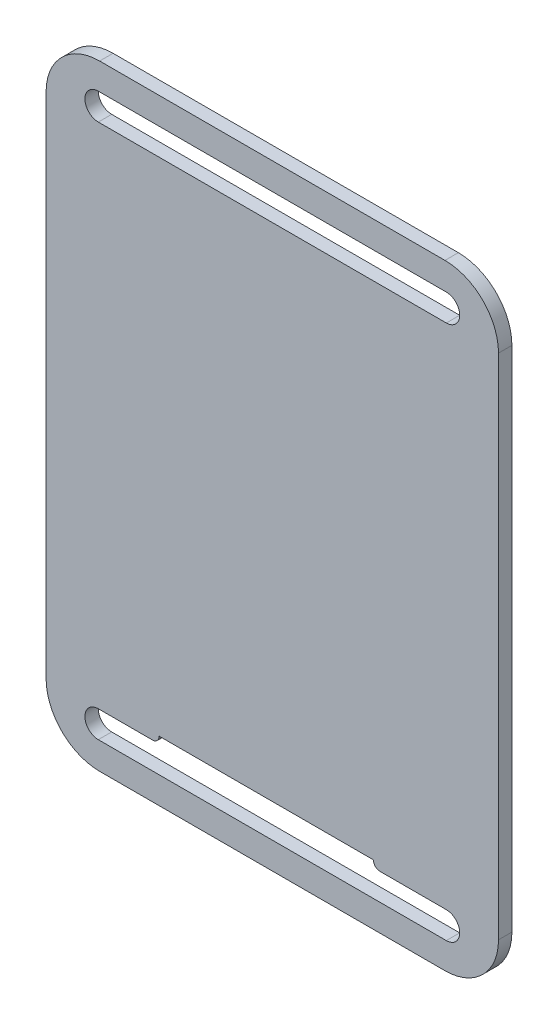
from build123d import *

# Parameters (mm, degrees)
BOSS_EXTRUDE1_DEPTH = 1


with BuildPart() as part:
    # Sketch1 → Boss-Extrude1 (new body)
    with BuildSketch(Plane(origin=(0, 0, 0.6), x_dir=(-1, 0, 0), z_dir=(0, 0, -1))):
        with BuildLine():
            Line((-4, 45.96), (-29.8, 45.96))
            ThreePointArc((-29.8, 45.96), (-32.628427125, 44.788427125), (-33.8, 41.96))
            Line((-33.8, 41.96), (-33.8, 4))
            ThreePointArc((-33.8, 4), (-32.628427125, 1.171572875), (-29.8, 0))
            Line((-29.8, 0), (-4, 0))
            ThreePointArc((-4, 0), (-1.171572875, 1.171572875), (0, 4))
            Line((0, 4), (0, 41.96))
            ThreePointArc((0, 41.96), (-1.171572875, 44.788427125), (-4, 45.96))
        make_face()
        with BuildLine():
            Line((-7.95, 4), (-3.9, 4))
            ThreePointArc((-3.9, 4), (-2.9, 3), (-3.9, 2))
            Line((-3.9, 2), (-29.9, 2))
            ThreePointArc((-29.9, 2), (-30.9, 3), (-29.9, 4))
            Line((-29.9, 4), (-24.95, 4))
            ThreePointArc((-24.95, 4), (-24.596446609, 4.146446609), (-24.45, 4.5))
            Line((-24.45, 4.5), (-8.45, 4.5))
            ThreePointArc((-8.45, 4.5), (-8.303553391, 4.146446609), (-7.95, 4))
        make_face(mode=Mode.SUBTRACT)
        with BuildLine():
            Line((-3.9, 41.96), (-29.9, 41.96))
            ThreePointArc((-29.9, 41.96), (-30.9, 42.96), (-29.9, 43.96))
            Line((-29.9, 43.96), (-3.9, 43.96))
            ThreePointArc((-3.9, 43.96), (-2.9, 42.96), (-3.9, 41.96))
        make_face(mode=Mode.SUBTRACT)
    extrude(amount=-BOSS_EXTRUDE1_DEPTH)


solid = part.part
